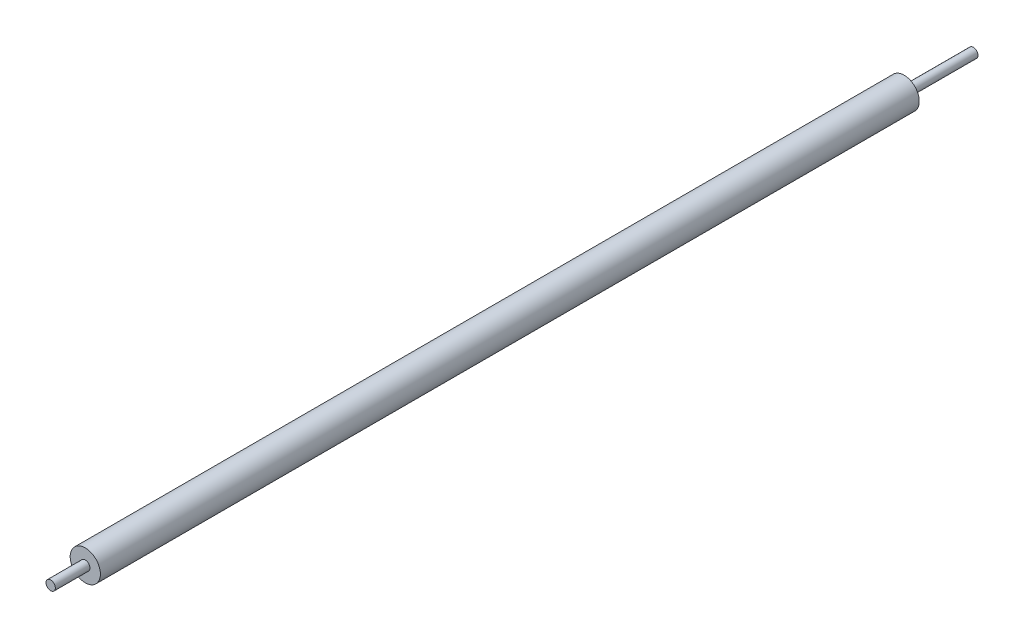
from build123d import *

# Parameters (mm, degrees)
WIRE_SKETCH_R     = 0.4064
COPPER_DEPTH      = 80
INSULATION_START  = 6
WIRE_SKETCH_3_R   = 1.31
WIRE_SKETCH_3_R_2 = 0.4064
INSULATION_DEPTH  = 71


with BuildPart() as part:
    # wire_sketch → copper (new body)
    with BuildSketch(Plane.XY):
        Circle(WIRE_SKETCH_R)
    extrude(amount=COPPER_DEPTH)


with BuildPart() as body_2:
    # wire_sketch<3> → insulation (new body)
    with BuildSketch(Plane.XY.offset(INSULATION_START)):
        Circle(WIRE_SKETCH_3_R)
        Circle(WIRE_SKETCH_3_R_2, mode=Mode.SUBTRACT)
    extrude(amount=INSULATION_DEPTH)


solid = Compound([part.part, body_2.part])
